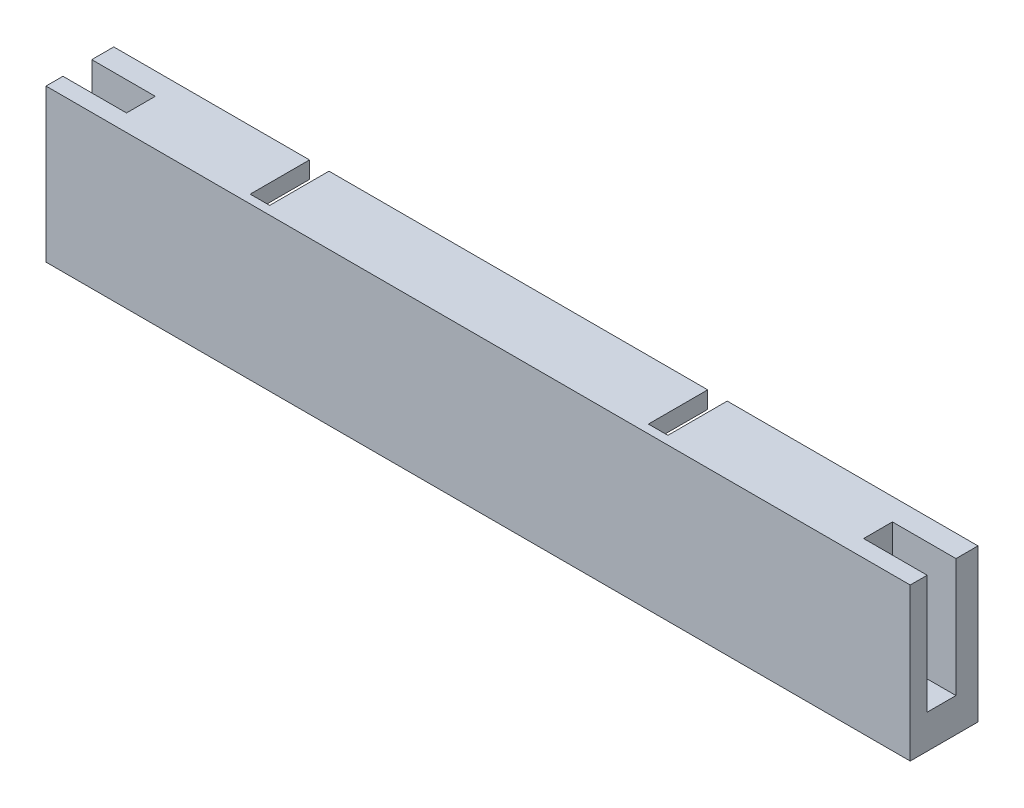
from build123d import *

# Parameters (mm, degrees)
SKETCH1_W            = 102
SKETCH1_H            = 18
BOSS_EXTRUDE1_DEPTH  = 2
BOSS_EXTRUDE2_DEPTH  = 18
SKETCH4_W            = 81
SKETCH4_H            = 2
BOSS_EXTRUDE3_DEPTH  = 6
SKETCH5_W            = 2.3
SKETCH5_H            = 2
CUT_EXTRUDE1_DEPTH   = 6
SKETCH8_W            = 2
SKETCH8_H            = 6
BOSS_EXTRUDE5_DEPTH  = 1
SKETCH10_W           = 3.5
SKETCH10_H           = 6
BOSS_EXTRUDE6_DEPTH  = 1
SKETCH11_W           = 1.5
SKETCH11_H           = 6
BOSS_EXTRUDE7_DEPTH  = 8
BOSS_EXTRUDE8_DEPTH  = 6
RIB1_REACH           = 54.402
SKETCH17_WALL_W      = 117.434725866
SKETCH17_WALL_H      = 4
CHAMFER1_SIZE        = 0.5
SKETCH18_W           = 7.5
SKETCH18_H           = 3.4
BOSS_EXTRUDE10_DEPTH = 4
SKETCH19_W           = 26.1754507
SKETCH19_H           = 11
CUT_EXTRUDE3_DEPTH   = 1
SKETCH20_W           = 2.3
SKETCH20_H           = 1
CUT_EXTRUDE4_DEPTH   = 18


with BuildPart() as part:
    # Sketch1 → Boss-Extrude1 (new body)
    with BuildSketch(Plane.XY):
        Rectangle(SKETCH1_W, SKETCH1_H)
    extrude(amount=BOSS_EXTRUDE1_DEPTH)

    # Sketch2 → Boss-Extrude2 (add)
    with BuildSketch(Plane(origin=(0, 9, 0), x_dir=(1, 0, 0), z_dir=(0, 1, 0))):
        Polygon((-43.5, 0), (-40.5, 0), (-40.5, 6), (-51, 6), (-51, 3.4), (-43.5, 3.4), align=None)
        Polygon((40.5, 6), (40.5, 0), (43.5, 0), (43.5, 3.4), (51, 3.4), (51, 6), align=None)
    extrude(amount=-BOSS_EXTRUDE2_DEPTH)

    # Sketch4 → Boss-Extrude3 (add)
    with BuildSketch(Plane(origin=(0, 0, 0), x_dir=(-1, 0, 0), z_dir=(0, 0, -1))):
        with Locations((0, 8)):
            Rectangle(SKETCH4_W, SKETCH4_H)
        with Locations((0, -8)):
            Rectangle(SKETCH4_W, SKETCH4_H)
    extrude(amount=BOSS_EXTRUDE3_DEPTH)

    # Sketch5 → Cut-Extrude1 (cut)
    with BuildSketch(Plane(origin=(0, 0, -6), x_dir=(-1, 0, 0), z_dir=(0, 0, -1))):
        with Locations((26.75, -8)):
            Rectangle(SKETCH5_W, SKETCH5_H)
        with Locations((26.75, 8)):
            Rectangle(SKETCH5_W, SKETCH5_H)
        with Locations((-20.25, 8)):
            Rectangle(SKETCH5_W, SKETCH5_H)
        with Locations((-20.25, -8)):
            Rectangle(SKETCH5_W, SKETCH5_H)
    extrude(amount=-CUT_EXTRUDE1_DEPTH, mode=Mode.SUBTRACT)

    # Sketch8 → Boss-Extrude5 (add)
    with BuildSketch(Plane(origin=(0, 0, 0), x_dir=(-1, 0, 0), z_dir=(0, 0, -1))):
        with Locations((33.75, 0)):
            Rectangle(SKETCH8_W, SKETCH8_H)
        with Locations((-13.25, 0)):
            Rectangle(SKETCH8_W, SKETCH8_H)
    extrude(amount=BOSS_EXTRUDE5_DEPTH)

    # Sketch10 → Boss-Extrude6 (add)
    with BuildSketch(Plane(origin=(0, 0, -1), x_dir=(-1, 0, 0), z_dir=(0, 0, -1))):
        with Locations((-14, 0)):
            Rectangle(SKETCH10_W, SKETCH10_H)
        with Locations((33, 0)):
            Rectangle(SKETCH10_W, SKETCH10_H)
    extrude(amount=BOSS_EXTRUDE6_DEPTH)

    # Sketch11 → Boss-Extrude7 (add)
    with BuildSketch(Plane(origin=(0, 0, 0), x_dir=(-1, 0, 0), z_dir=(0, 0, -1))):
        with Locations((5.8, 0)):
            Rectangle(SKETCH11_W, SKETCH11_H)
        with Locations((-41.2, 0)):
            Rectangle(SKETCH11_W, SKETCH11_H)
    extrude(amount=BOSS_EXTRUDE7_DEPTH)

    # Sketch12 → Boss-Extrude8 (add)
    with BuildSketch(Plane.XZ.offset(3)):
        Polygon((-6.55, -8), (-7.55, -6), (-6.55, -6), align=None)
        Polygon((40.45, -8), (39.45, -6), (40.45, -6), align=None)
    extrude(amount=-BOSS_EXTRUDE8_DEPTH)

    # Sketch17 wall → Rib1 (add, up to next)
    with BuildSketch(Plane(origin=(-1.55, 0, -4), x_dir=(0.658504607869, 0, 0.752576694707), z_dir=(0.752576694707, 0, -0.658504607869)), mode=Mode.PRIVATE) as rib1_sk1:
        Rectangle(SKETCH17_WALL_W, SKETCH17_WALL_H)
    rib1_tool1 = extrude(rib1_sk1.sketch, amount=-RIB1_REACH, mode=Mode.PRIVATE) - part.part
    add(rib1_tool1.solids().sort_by_distance((-1.55, 0, -4))[0])

    # Chamfer1
    chamfer1_edges = [part.edges().sort_by_distance(p)[0] for p in [
        (-31.25, 0, -1),
        (15.75, 0, -1),
    ]]
    chamfer(chamfer1_edges, length=CHAMFER1_SIZE)

    # Sketch18 → Boss-Extrude10 (add)
    with BuildSketch(Plane.XZ.offset(9)):
        with Locations((47.25, -1.7)):
            Rectangle(SKETCH18_W, SKETCH18_H)
        with Locations((-47.25, -1.7)):
            Rectangle(SKETCH18_W, SKETCH18_H)
    extrude(amount=-BOSS_EXTRUDE10_DEPTH)

    # Sketch19 → Cut-Extrude3 (cut)
    with BuildSketch(Plane(origin=(0, 0, 0), x_dir=(-1, 0, 0), z_dir=(0, 0, -1))):
        with Locations((19.63772535, 0)):
            Rectangle(SKETCH19_W, SKETCH19_H)
        with Locations((-27.35772535, -0.484068742)):
            Rectangle(SKETCH19_W, SKETCH19_H)
    extrude(amount=-CUT_EXTRUDE3_DEPTH, mode=Mode.SUBTRACT)

    # Sketch20 → Cut-Extrude4 (cut)
    with BuildSketch(Plane(origin=(0, 9, 0), x_dir=(1, 0, 0), z_dir=(0, 1, 0))):
        with Locations((-26.75, -0.5)):
            Rectangle(SKETCH20_W, SKETCH20_H)
        with Locations((20.25, -0.5)):
            Rectangle(SKETCH20_W, SKETCH20_H)
    extrude(amount=-CUT_EXTRUDE4_DEPTH, mode=Mode.SUBTRACT)


solid = part.part
